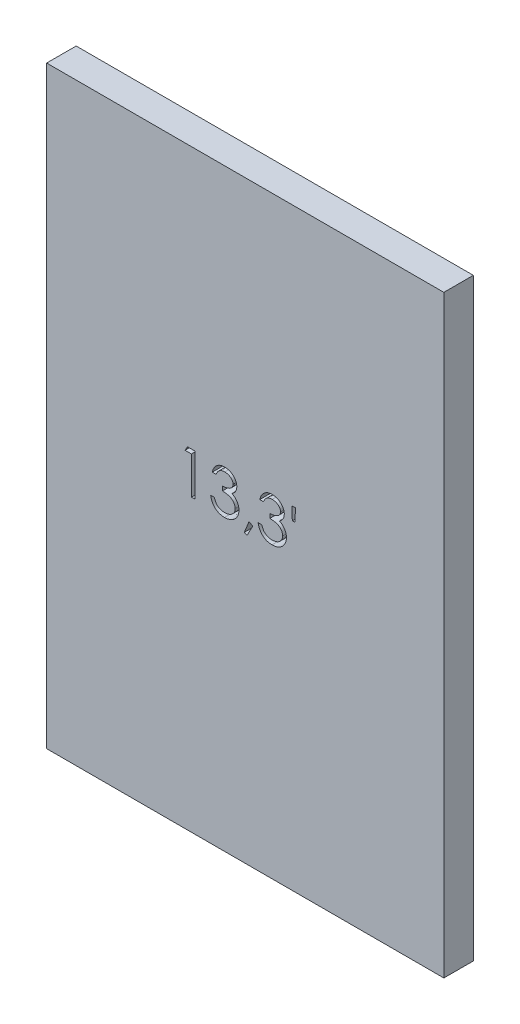
from build123d import *

# Parameters (mm, degrees)
ESBO_O1_W                = 202
ESBO_O1_H                = 302
RESSALTO_EXTRUS_O1_DEPTH = 15
CORTE_EXTRUS_O1_DEPTH    = 10


with BuildPart() as part:
    # Esboço1 → Ressalto-extrusão1 (new body)
    with BuildSketch(Plane.XY):
        Rectangle(ESBO_O1_W, ESBO_O1_H)
    extrude(amount=RESSALTO_EXTRUS_O1_DEPTH)

    # Esboço3 → Corte-extrusão1 (cut)
    with BuildSketch(Plane.XY.offset(15)):
        Polygon((-29.37748621, 17.796633853), (-25.463857737, 17.796633853), (-25.463857737, -3.370032813), (-27.363430387, -3.370032813), (-27.363430387, 15.625693682), (-30.619840643, 15.625693682), align=None)
        with BuildLine():
            Line((-14.880524404, 12.912018469), (-16.780097054, 12.912018469))
            add(Edge.make_bspline(
                [(-16.780097054, 12.912018469), (-16.728634533, 13.12509111), (-16.628029514, 13.541630696), (-16.418191808, 14.136760321), (-16.189596312, 14.699935902), (-15.915100299, 15.220612158), (-15.615690214, 15.709253141), (-15.272652803, 16.154775941), (-14.90181448, 16.568511494), (-14.491635025, 16.935682026), (-14.061475976, 17.268166388), (-13.605276133, 17.551648878), (-13.132213871, 17.795513993), (-12.639011591, 17.9964173), (-12.124200934, 18.147762134), (-11.592436069, 18.257567577), (-11.042323473, 18.328875744), (-10.668897568, 18.335835121), (-10.479282417, 18.339368896)],
                knots=[0, 0, 0, 0, 1.162005537, 2.271625781, 3.343758855, 4.383309926, 5.390229558, 6.379919256, 7.361854164, 8.333198761, 9.295911338, 10.242430842, 11.177959212, 12.116337295, 13.062827104, 14.020064771, 14.994644689, 16, 16, 16, 16], degree=3))
            add(Edge.make_bspline(
                [(-10.479282417, 18.339368896), (-10.203010596, 18.331027837), (-9.656493244, 18.314527662), (-8.853592912, 18.163854641), (-8.079335483, 17.92542646), (-7.342195746, 17.59599011), (-6.657493796, 17.189666835), (-6.048279714, 16.706070569), (-5.522811102, 16.154531936), (-5.081973675, 15.545339761), (-4.736805823, 14.894280252), (-4.482283469, 14.224203111), (-4.327333303, 13.536697856), (-4.307251841, 13.072499072), (-4.297191071, 12.839936471)],
                knots=[0, 0, 0, 0, 1.083050992, 2.142477498, 3.193116406, 4.255571735, 5.30263384, 6.308962982, 7.297363603, 8.282367274, 9.249857812, 10.179914175, 11.08814088, 12, 12, 12, 12], degree=3))
            add(Edge.make_bspline(
                [(-4.297191071, 12.839936471), (-4.304228026, 12.616133474), (-4.317998256, 12.17818574), (-4.434921142, 11.5388224), (-4.631688065, 10.936227961), (-4.90425282, 10.367865694), (-5.25708029, 9.837339282), (-5.684481838, 9.343455085), (-6.189474126, 8.884022557), (-6.572161037, 8.620833364), (-6.769179586, 8.485335776)],
                knots=[0, 0, 0, 0, 1.024540389, 2.004866551, 2.965041327, 3.920577974, 4.882998113, 5.874504559, 6.905732034, 8, 8, 8, 8], degree=3))
            add(Edge.make_bspline(
                [(-6.769179586, 8.485335776), (-6.544016118, 8.376610644), (-6.097902164, 8.16119471), (-5.489810866, 7.7387337), (-4.937797048, 7.250954837), (-4.629950748, 6.870301651), (-4.475276007, 6.679045712)],
                knots=[0, 0, 0, 0, 1.015518401, 2.012035669, 3.001164323, 4, 4, 4, 4], degree=3))
            add(Edge.make_bspline(
                [(-4.475276007, 6.679045712), (-4.373425984, 6.539601215), (-4.171393803, 6.262995719), (-3.922017004, 5.818275429), (-3.695780931, 5.368625946), (-3.51949151, 4.901995253), (-3.382973363, 4.423791789), (-3.285388787, 3.933194441), (-3.224766601, 3.429802592), (-3.21608493, 3.089246164), (-3.211720985, 2.918061471)],
                knots=[0, 0, 0, 0, 1.025084078, 2.033381695, 3.024893161, 4.013698104, 4.991890475, 5.976764909, 6.982997093, 8, 8, 8, 8], degree=3))
            add(Edge.make_bspline(
                [(-3.211720985, 2.918061471), (-3.222573519, 2.621669348), (-3.244227516, 2.030279927), (-3.437775965, 1.156551848), (-3.737817944, 0.302473811), (-4.163914652, -0.51440736), (-4.683208634, -1.278707759), (-5.301017214, -1.9625502), (-6.010320731, -2.550370331), (-6.801383465, -3.041498853), (-7.658434671, -3.434097715), (-8.575106108, -3.706587965), (-9.538189768, -3.884061392), (-10.1986339, -3.903092456), (-10.534403945, -3.912767856)],
                knots=[0, 0, 0, 0, 0.955779014, 1.907060117, 2.875433937, 3.871313158, 4.872415639, 5.851225146, 6.836215519, 7.83643374, 8.849228613, 9.86973379, 10.916971861, 12, 12, 12, 12], degree=3))
            add(Edge.make_bspline(
                [(-10.534403945, -3.912767856), (-10.760701618, -3.907517233), (-11.205979977, -3.897185758), (-11.86059542, -3.826558027), (-12.485445697, -3.697562281), (-13.081375646, -3.523975624), (-13.648914675, -3.303892232), (-14.186330931, -3.02982201), (-14.696930763, -2.707414355), (-15.175895848, -2.33286361), (-15.623169091, -1.91387646), (-16.026864138, -1.443014828), (-16.393711457, -0.928982909), (-16.713888367, -0.365810141), (-17.001978509, 0.239225463), (-17.238930009, 0.893871143), (-17.447485591, 1.592274514), (-17.544449874, 2.078973229), (-17.594199618, 2.328685135)],
                knots=[0, 0, 0, 0, 1.048658725, 2.063410685, 3.046034179, 4.001477787, 4.936774919, 5.862367409, 6.792675028, 7.730719943, 8.675894397, 9.627829632, 10.600096036, 11.597688215, 12.626045268, 13.701542398, 14.82072376, 16, 16, 16, 16], degree=3))
            Line((-17.594199618, 2.328685135), (-15.694626968, 2.328685135))
            add(Edge.make_bspline(
                [(-15.694626968, 2.328685135), (-15.645137539, 2.165707769), (-15.548876301, 1.848702636), (-15.385020308, 1.392468407), (-15.198340758, 0.974226847), (-14.998076522, 0.590909871), (-14.787749729, 0.238742485), (-14.552407087, -0.072963104), (-14.3094794, -0.357897899), (-14.126361406, -0.518429599), (-14.036741017, -0.596995954)],
                knots=[0, 0, 0, 0, 1.198163088, 2.33053128, 3.407730985, 4.417276592, 5.372219308, 6.28897303, 7.162600585, 8, 8, 8, 8], degree=3))
            add(Edge.make_bspline(
                [(-14.036741017, -0.596995954), (-13.918228388, -0.688365402), (-13.68156895, -0.870822261), (-13.295922981, -1.103665443), (-12.890340099, -1.305420215), (-12.456032307, -1.459535899), (-12.002371553, -1.590029371), (-11.522025106, -1.675424892), (-11.019230793, -1.734015261), (-10.675920985, -1.739185561), (-10.500483005, -1.741827685)],
                knots=[0, 0, 0, 0, 0.946170439, 1.889420265, 2.845303464, 3.807233317, 4.801018734, 5.828864929, 6.890507805, 8, 8, 8, 8], degree=3))
            add(Edge.make_bspline(
                [(-10.500483005, -1.741827685), (-10.302402298, -1.738102925), (-9.915072576, -1.730819478), (-9.349893189, -1.663837822), (-8.812214815, -1.566287226), (-8.308007122, -1.415622997), (-7.830665482, -1.229472133), (-7.38688122, -0.9957413), (-6.970828578, -0.721513698), (-6.587836459, -0.409824501), (-6.243451723, -0.068608792), (-5.940227048, 0.288279781), (-5.682449333, 0.659336464), (-5.474510551, 1.046614624), (-5.310314366, 1.448510532), (-5.19853501, 1.866152023), (-5.120813942, 2.296121205), (-5.11448443, 2.588396398), (-5.111293635, 2.735736417)],
                knots=[0, 0, 0, 0, 1.217147791, 2.380027433, 3.494444702, 4.572153297, 5.609568379, 6.639424714, 7.649109417, 8.668170816, 9.669597737, 10.625200337, 11.543417969, 12.441394052, 13.322311151, 14.205496177, 15.095365482, 16, 16, 16, 16], degree=3))
            add(Edge.make_bspline(
                [(-5.111293635, 2.735736417), (-5.120548316, 2.932957372), (-5.139011627, 3.326417936), (-5.279973036, 3.905281361), (-5.511831881, 4.463013427), (-5.836422783, 4.990098443), (-6.23154838, 5.478600324), (-6.693374245, 5.914461194), (-7.225735436, 6.274113649), (-7.715712739, 6.522602191), (-8.149721067, 6.69215974), (-8.521137915, 6.805098811), (-8.93695166, 6.900733776), (-9.392133865, 6.98970799), (-9.890114269, 7.065432334), (-10.430350727, 7.128580457), (-11.012952714, 7.179108562), (-11.416275479, 7.201672805), (-11.624114148, 7.21330052)],
                knots=[0, 0, 0, 0, 1.07054697, 2.135767047, 3.216561865, 4.33974944, 5.486079747, 6.621378074, 7.775625952, 8.963672916, 9.598146892, 10.304877434, 11.070270905, 11.915000392, 12.823868403, 13.805723172, 14.86925407, 16, 16, 16, 16], degree=3))
            Line((-11.624114148, 7.21330052), (-11.624114148, 9.384240691))
            add(Edge.make_bspline(
                [(-11.624114148, 9.384240691), (-11.362245193, 9.388684504), (-10.84930824, 9.397388842), (-10.100042683, 9.502665857), (-9.383561224, 9.648296322), (-8.715742355, 9.871363913), (-8.107057279, 10.130445709), (-7.578981591, 10.431932881), (-7.138913605, 10.767060174), (-6.788991887, 11.14100024), (-6.525743694, 11.542048384), (-6.333267348, 11.9600396), (-6.219570137, 12.398637492), (-6.204392627, 12.697962388), (-6.19676372, 12.848416706)],
                knots=[0, 0, 0, 0, 1.321986639, 2.589447074, 3.816329219, 5.01088745, 6.139805852, 7.153945165, 8.075214402, 8.924034688, 9.728124013, 10.488707548, 11.240355623, 12, 12, 12, 12], degree=3))
            add(Edge.make_bspline(
                [(-6.19676372, 12.848416706), (-6.19926992, 12.958953546), (-6.204255885, 13.178861346), (-6.26713466, 13.500141523), (-6.361622908, 13.811599625), (-6.491524128, 14.111911144), (-6.665394378, 14.398993276), (-6.873468677, 14.675293563), (-7.121228141, 14.939234512), (-7.40513632, 15.185253587), (-7.710007712, 15.419715165), (-8.044137304, 15.618764302), (-8.397450547, 15.788974916), (-8.770338602, 15.929337143), (-9.164011571, 16.034924267), (-9.576619801, 16.11073626), (-10.008950077, 16.15813541), (-10.303902933, 16.16495964), (-10.453841712, 16.168428725)],
                knots=[0, 0, 0, 0, 0.884392785, 1.759457502, 2.611959086, 3.489218968, 4.37281399, 5.2945488, 6.255912374, 7.266815255, 8.301784654, 9.332968512, 10.37626691, 11.440494194, 12.520033166, 13.637162961, 14.798855837, 16, 16, 16, 16], degree=3))
            add(Edge.make_bspline(
                [(-10.453841712, 16.168428725), (-10.694849418, 16.160014298), (-11.165593523, 16.143578964), (-11.844226592, 15.999627407), (-12.475110183, 15.769950426), (-12.957339262, 15.495793594), (-13.313438639, 15.225160018), (-13.567903932, 14.988804633), (-13.817794638, 14.726139462), (-14.046670874, 14.42098643), (-14.278137305, 14.09401108), (-14.488863939, 13.728591673), (-14.693634458, 13.334260336), (-14.817021306, 13.055491498), (-14.880524404, 12.912018469)],
                knots=[0, 0, 0, 0, 1.472543308, 2.876219568, 4.221790263, 5.565193594, 6.249813518, 6.953379497, 7.687249741, 8.463570142, 9.283606569, 10.136032583, 11.040678096, 12, 12, 12, 12], degree=3))
        make_face()
        Polygon((1.901860745, 0.429112486), (3.84383457, -0.512193604), (0.926633716, -6.083708027), (-0.498045772, -5.464650869), align=None)
        with BuildLine():
            Line((9.271184998, 12.912018469), (7.371612348, 12.912018469))
            add(Edge.make_bspline(
                [(7.371612348, 12.912018469), (7.423074869, 13.12509111), (7.523679888, 13.541630696), (7.733517594, 14.136760321), (7.96211309, 14.699935902), (8.236609103, 15.220612158), (8.536019188, 15.709253141), (8.879056599, 16.154775941), (9.249894921, 16.568511494), (9.660074377, 16.935682026), (10.090233426, 17.268166388), (10.546433269, 17.551648878), (11.019495531, 17.795513993), (11.512697811, 17.9964173), (12.027508468, 18.147762134), (12.559273333, 18.257567577), (13.109385929, 18.328875744), (13.482811834, 18.335835121), (13.672426985, 18.339368896)],
                knots=[0, 0, 0, 0, 1.162005537, 2.271625781, 3.343758855, 4.383309926, 5.390229558, 6.379919256, 7.361854164, 8.333198761, 9.295911338, 10.242430842, 11.177959212, 12.116337295, 13.062827104, 14.020064771, 14.994644689, 16, 16, 16, 16], degree=3))
            add(Edge.make_bspline(
                [(13.672426985, 18.339368896), (13.948698806, 18.331027837), (14.495216158, 18.314527662), (15.298116489, 18.163854641), (16.072373919, 17.92542646), (16.809513656, 17.59599011), (17.494215605, 17.189666835), (18.103429687, 16.706070569), (18.6288983, 16.154531936), (19.069735727, 15.545339761), (19.414903578, 14.894280252), (19.669425932, 14.224203111), (19.824376098, 13.536697856), (19.844457561, 13.072499072), (19.854518331, 12.839936471)],
                knots=[0, 0, 0, 0, 1.083050992, 2.142477498, 3.193116406, 4.255571735, 5.30263384, 6.308962982, 7.297363603, 8.282367274, 9.249857812, 10.179914175, 11.08814088, 12, 12, 12, 12], degree=3))
            add(Edge.make_bspline(
                [(19.854518331, 12.839936471), (19.847481376, 12.616133474), (19.833711146, 12.17818574), (19.71678826, 11.5388224), (19.520021337, 10.936227961), (19.247456582, 10.367865694), (18.894629112, 9.837339282), (18.467227564, 9.343455085), (17.962235276, 8.884022557), (17.579548365, 8.620833364), (17.382529816, 8.485335776)],
                knots=[0, 0, 0, 0, 1.024540389, 2.004866551, 2.965041327, 3.920577974, 4.882998113, 5.874504559, 6.905732034, 8, 8, 8, 8], degree=3))
            add(Edge.make_bspline(
                [(17.382529816, 8.485335776), (17.607693284, 8.376610644), (18.053807238, 8.16119471), (18.661898536, 7.7387337), (19.213912353, 7.250954837), (19.521758654, 6.870301651), (19.676433395, 6.679045712)],
                knots=[0, 0, 0, 0, 1.015518401, 2.012035669, 3.001164323, 4, 4, 4, 4], degree=3))
            add(Edge.make_bspline(
                [(19.676433395, 6.679045712), (19.778283418, 6.539601215), (19.980315599, 6.262995719), (20.229692398, 5.818275429), (20.45592847, 5.368625946), (20.632217892, 4.901995253), (20.768736039, 4.423791789), (20.866320615, 3.933194441), (20.9269428, 3.429802592), (20.935624472, 3.089246164), (20.939988416, 2.918061471)],
                knots=[0, 0, 0, 0, 1.025084078, 2.033381695, 3.024893161, 4.013698104, 4.991890475, 5.976764909, 6.982997093, 8, 8, 8, 8], degree=3))
            add(Edge.make_bspline(
                [(20.939988416, 2.918061471), (20.929135882, 2.621669348), (20.907481886, 2.030279927), (20.713933437, 1.156551848), (20.413891457, 0.302473811), (19.987794749, -0.51440736), (19.468500767, -1.278707759), (18.850692188, -1.9625502), (18.14138867, -2.550370331), (17.350325937, -3.041498853), (16.493274731, -3.434097715), (15.576603294, -3.706587965), (14.613519634, -3.884061392), (13.953075501, -3.903092456), (13.617305457, -3.912767856)],
                knots=[0, 0, 0, 0, 0.955779014, 1.907060117, 2.875433937, 3.871313158, 4.872415639, 5.851225146, 6.836215519, 7.83643374, 8.849228613, 9.86973379, 10.916971861, 12, 12, 12, 12], degree=3))
            add(Edge.make_bspline(
                [(13.617305457, -3.912767856), (13.391007784, -3.907517233), (12.945729425, -3.897185758), (12.291113982, -3.826558027), (11.666263705, -3.697562281), (11.070333756, -3.523975624), (10.502794726, -3.303892232), (9.965378471, -3.02982201), (9.454778639, -2.707414355), (8.975813553, -2.33286361), (8.528540311, -1.91387646), (8.124845264, -1.443014828), (7.757997945, -0.928982909), (7.437821035, -0.365810141), (7.149730893, 0.239225463), (6.912779393, 0.893871143), (6.704223811, 1.592274514), (6.607259527, 2.078973229), (6.557509784, 2.328685135)],
                knots=[0, 0, 0, 0, 1.048658725, 2.063410685, 3.046034179, 4.001477787, 4.936774919, 5.862367409, 6.792675028, 7.730719943, 8.675894397, 9.627829632, 10.600096036, 11.597688215, 12.626045268, 13.701542398, 14.82072376, 16, 16, 16, 16], degree=3))
            Line((6.557509784, 2.328685135), (8.457082433, 2.328685135))
            add(Edge.make_bspline(
                [(8.457082433, 2.328685135), (8.506571863, 2.165707769), (8.602833101, 1.848702636), (8.766689094, 1.392468407), (8.953368644, 0.974226847), (9.15363288, 0.590909871), (9.363959672, 0.238742485), (9.599302315, -0.072963104), (9.842230002, -0.357897899), (10.025347996, -0.518429599), (10.114968384, -0.596995954)],
                knots=[0, 0, 0, 0, 1.198163088, 2.33053128, 3.407730985, 4.417276592, 5.372219308, 6.28897303, 7.162600585, 8, 8, 8, 8], degree=3))
            add(Edge.make_bspline(
                [(10.114968384, -0.596995954), (10.233481014, -0.688365402), (10.470140451, -0.870822261), (10.85578642, -1.103665443), (11.261369303, -1.305420215), (11.695677094, -1.459535899), (12.149337849, -1.590029371), (12.629684296, -1.675424892), (13.132478609, -1.734015261), (13.475788417, -1.739185561), (13.651226397, -1.741827685)],
                knots=[0, 0, 0, 0, 0.946170439, 1.889420265, 2.845303464, 3.807233317, 4.801018734, 5.828864929, 6.890507805, 8, 8, 8, 8], degree=3))
            add(Edge.make_bspline(
                [(13.651226397, -1.741827685), (13.849307104, -1.738102925), (14.236636825, -1.730819478), (14.801816213, -1.663837822), (15.339494586, -1.566287226), (15.84370228, -1.415622997), (16.32104392, -1.229472133), (16.764828182, -0.9957413), (17.180880824, -0.721513698), (17.563872943, -0.409824501), (17.908257679, -0.068608792), (18.211482354, 0.288279781), (18.469260069, 0.659336464), (18.677198851, 1.046614624), (18.841395036, 1.448510532), (18.953174392, 1.866152023), (19.03089546, 2.296121205), (19.037224971, 2.588396398), (19.040415767, 2.735736417)],
                knots=[0, 0, 0, 0, 1.217147791, 2.380027433, 3.494444702, 4.572153297, 5.609568379, 6.639424714, 7.649109417, 8.668170816, 9.669597737, 10.625200337, 11.543417969, 12.441394052, 13.322311151, 14.205496177, 15.095365482, 16, 16, 16, 16], degree=3))
            add(Edge.make_bspline(
                [(19.040415767, 2.735736417), (19.031161086, 2.932957372), (19.012697775, 3.326417936), (18.871736366, 3.905281361), (18.63987752, 4.463013427), (18.315286619, 4.990098443), (17.920161022, 5.478600324), (17.458335156, 5.914461194), (16.925973966, 6.274113649), (16.435996663, 6.522602191), (16.001988335, 6.69215974), (15.630571486, 6.805098811), (15.214757742, 6.900733776), (14.759575537, 6.98970799), (14.261595133, 7.065432334), (13.721358675, 7.128580457), (13.138756688, 7.179108562), (12.735433923, 7.201672805), (12.527595254, 7.21330052)],
                knots=[0, 0, 0, 0, 1.07054697, 2.135767047, 3.216561865, 4.33974944, 5.486079747, 6.621378074, 7.775625952, 8.963672916, 9.598146892, 10.304877434, 11.070270905, 11.915000392, 12.823868403, 13.805723172, 14.86925407, 16, 16, 16, 16], degree=3))
            Line((12.527595254, 7.21330052), (12.527595254, 9.384240691))
            add(Edge.make_bspline(
                [(12.527595254, 9.384240691), (12.789464209, 9.388684504), (13.302401162, 9.397388842), (14.051666719, 9.502665857), (14.768148178, 9.648296322), (15.435967046, 9.871363913), (16.044652122, 10.130445709), (16.572727811, 10.431932881), (17.012795797, 10.767060174), (17.362717515, 11.14100024), (17.625965707, 11.542048384), (17.818442054, 11.9600396), (17.932139265, 12.398637492), (17.947316774, 12.697962388), (17.954945681, 12.848416706)],
                knots=[0, 0, 0, 0, 1.321986639, 2.589447074, 3.816329219, 5.01088745, 6.139805852, 7.153945165, 8.075214402, 8.924034688, 9.728124013, 10.488707548, 11.240355623, 12, 12, 12, 12], degree=3))
            add(Edge.make_bspline(
                [(17.954945681, 12.848416706), (17.952439482, 12.958953546), (17.947453516, 13.178861346), (17.884574741, 13.500141523), (17.790086493, 13.811599625), (17.660185273, 14.111911144), (17.486315024, 14.398993276), (17.278240725, 14.675293563), (17.030481261, 14.939234512), (16.746573081, 15.185253587), (16.441701689, 15.419715165), (16.107572098, 15.618764302), (15.754258855, 15.788974916), (15.3813708, 15.929337143), (14.987697831, 16.034924267), (14.575089601, 16.11073626), (14.142759324, 16.15813541), (13.847806469, 16.16495964), (13.69786769, 16.168428725)],
                knots=[0, 0, 0, 0, 0.884392785, 1.759457502, 2.611959086, 3.489218968, 4.37281399, 5.2945488, 6.255912374, 7.266815255, 8.301784654, 9.332968512, 10.37626691, 11.440494194, 12.520033166, 13.637162961, 14.798855837, 16, 16, 16, 16], degree=3))
            add(Edge.make_bspline(
                [(13.69786769, 16.168428725), (13.456859983, 16.160014298), (12.986115879, 16.143578964), (12.30748281, 15.999627407), (11.676599218, 15.769950426), (11.194370139, 15.495793594), (10.838270762, 15.225160018), (10.583805469, 14.988804633), (10.333914764, 14.726139462), (10.105038527, 14.42098643), (9.873572097, 14.09401108), (9.662845463, 13.728591673), (9.458074943, 13.334260336), (9.334688096, 13.055491498), (9.271184998, 12.912018469)],
                knots=[0, 0, 0, 0, 1.472543308, 2.876219568, 4.221790263, 5.565193594, 6.249813518, 6.953379497, 7.687249741, 8.463570142, 9.283606569, 10.136032583, 11.040678096, 12, 12, 12, 12], degree=3))
        make_face()
        Polygon((25.256428053, 11.826548383), (23.937751504, 11.826548383), (23.65366363, 18.339368896), (25.55323628, 18.339368896), align=None)
    extrude(amount=-CORTE_EXTRUS_O1_DEPTH, mode=Mode.SUBTRACT)


solid = part.part
